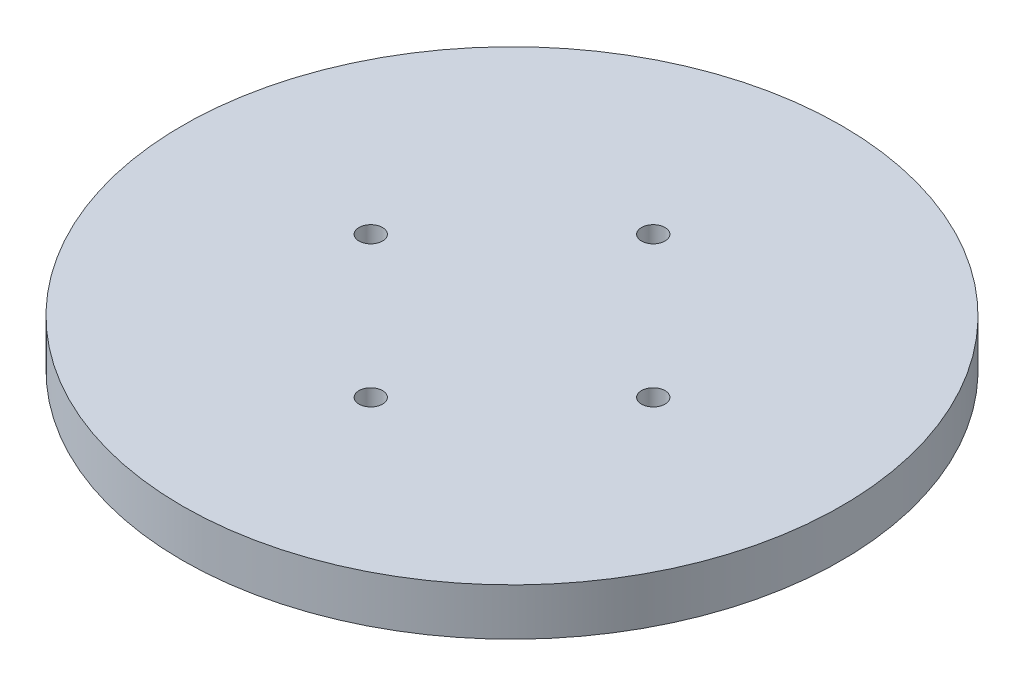
from build123d import *

# Parameters (mm, degrees)
CROQUIS1_R              = 70
CROQUIS1_R_2            = 2.5
SALIENTE_EXTRUIR1_DEPTH = 10


with BuildPart() as part:
    # Croquis1 → Saliente-Extruir1 (new body)
    with BuildSketch(Plane(origin=(0, 0, 0), x_dir=(1, 0, 0), z_dir=(0, 1, 0))):
        with Locations(Location((0, 0, 0), (0, 0, 270))):
            Circle(CROQUIS1_R)
        with Locations(Location((0, 30, 0), (0, 0, 270))):
            Circle(CROQUIS1_R_2, mode=Mode.SUBTRACT)
        with Locations(Location((30, 0, 0), (0, 0, 270))):
            Circle(CROQUIS1_R_2, mode=Mode.SUBTRACT)
        with Locations(Location((0, -30, 0), (0, 0, 270))):
            Circle(CROQUIS1_R_2, mode=Mode.SUBTRACT)
        with Locations(Location((-30, 0, 0), (0, 0, 270))):
            Circle(CROQUIS1_R_2, mode=Mode.SUBTRACT)
    extrude(amount=SALIENTE_EXTRUIR1_DEPTH)


solid = part.part
